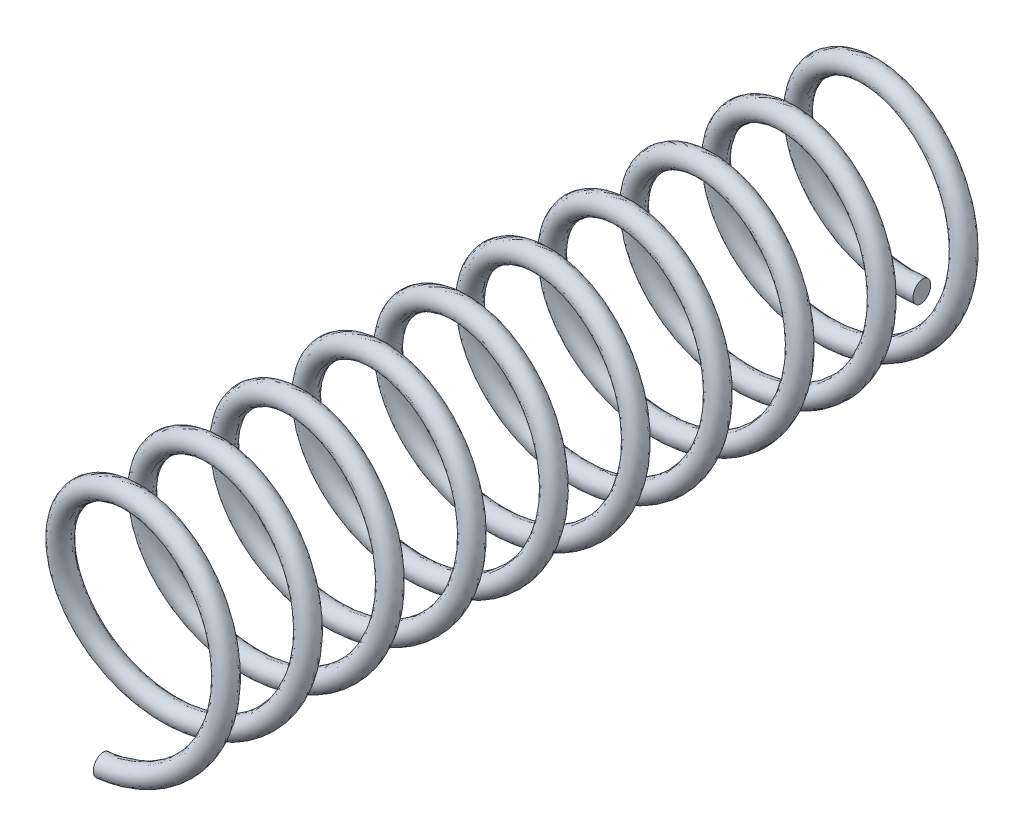
from build123d import *

# Parameters (mm, degrees)
SWEEP4_PITCH       = 20
SWEEP4_HEIGHT      = 200
SWEEP4_RADIUS      = 25
SWEEP4_START_ANGLE = -90
SWEEP4_PROFILE_R   = 2.5


with BuildPart() as part:
    # Sweep4: sweep along a helix
    with BuildLine() as sweep4_path:
        add(Helix(SWEEP4_PITCH, SWEEP4_HEIGHT, SWEEP4_RADIUS, center=(0, 0, 0), direction=(0, 0, 1), lefthand=True, mode=Mode.PRIVATE).rotate(Axis((0, 0, 0), (0, 0, 1)), SWEEP4_START_ANGLE))
    # Sweep4 profile (on start of the path) → Sweep4 (sweep)
    with BuildSketch(Plane(origin=(0, -25, 0), x_dir=(-0.12630428643443417, 0, -0.9919915459459765), z_dir=(-0.9919915459459765, 3.3910560754938295e-13, 0.12630428643443417))):
        Circle(SWEEP4_PROFILE_R)
    sweep(path=sweep4_path.line, is_frenet=True)


solid = part.part
